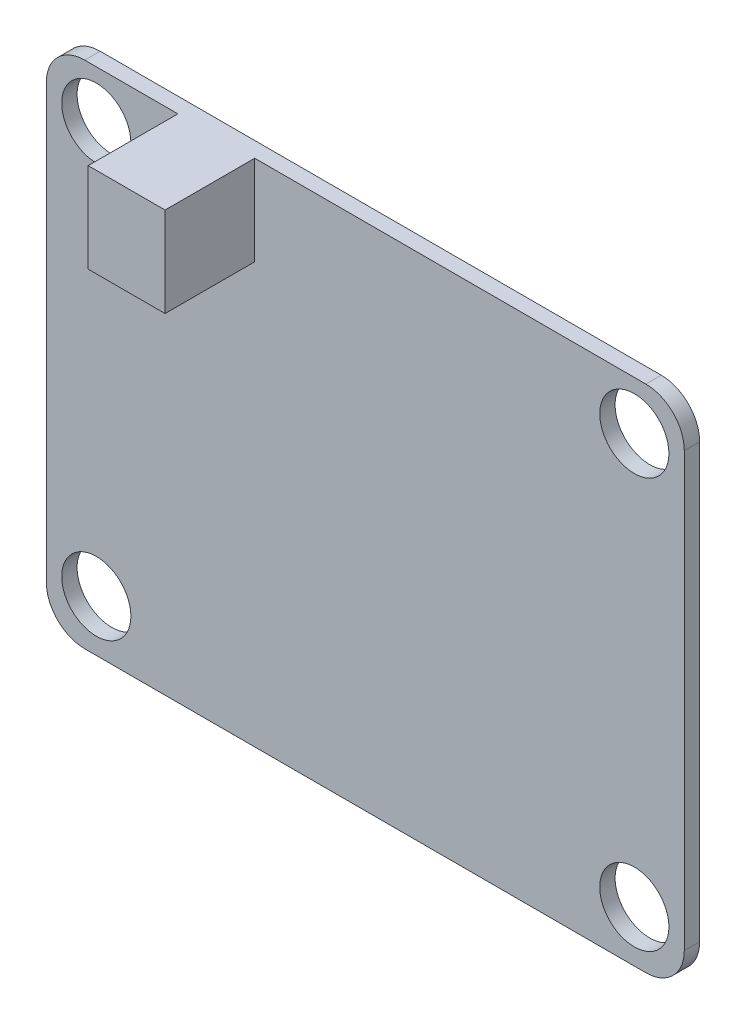
from build123d import *

# Parameters (mm, degrees)
CROQUIS1_W              = 49.8
CROQUIS1_H              = 39.8
CROQUIS1_R              = 2.7
SALIENTE_EXTRUIR1_DEPTH = 1.2
REDONDEO1_R             = 3
CROQUIS2_W              = 6
CROQUIS2_H              = 7
SALIENTE_EXTRUIR2_DEPTH = 7


with BuildPart() as part:
    # Croquis1 → Saliente-Extruir1 (new body)
    with BuildSketch(Plane.XY):
        with Locations((-31.963412372, -3.757931034)):
            Rectangle(CROQUIS1_W, CROQUIS1_H)
        with Locations((-52.963412372, 12.342068966)):
            Circle(CROQUIS1_R, mode=Mode.SUBTRACT)
        with Locations((-10.963412372, 12.342068966)):
            Circle(CROQUIS1_R, mode=Mode.SUBTRACT)
        with Locations((-10.963412372, -19.657931034)):
            Circle(CROQUIS1_R, mode=Mode.SUBTRACT)
        with Locations((-52.963412372, -19.657931034)):
            Circle(CROQUIS1_R, mode=Mode.SUBTRACT)
    extrude(amount=SALIENTE_EXTRUIR1_DEPTH)

    # Redondeo1
    redondeo1_edges = [part.edges().sort_by_distance(p)[0] for p in [
        (-56.863412372, 16.142068966, 0.6),
        (-7.063412372, 16.142068966, 0.6),
        (-7.063412372, -23.657931034, 0.6),
        (-56.863412372, -23.657931034, 0.6),
    ]]
    fillet(redondeo1_edges, radius=REDONDEO1_R)

    # Croquis2 → Saliente-Extruir2 (add)
    with BuildSketch(Plane.XY.offset(1.2)):
        with Locations((-43.595564528, 12.642068966)):
            Rectangle(CROQUIS2_W, CROQUIS2_H)
    extrude(amount=SALIENTE_EXTRUIR2_DEPTH)


solid = part.part
